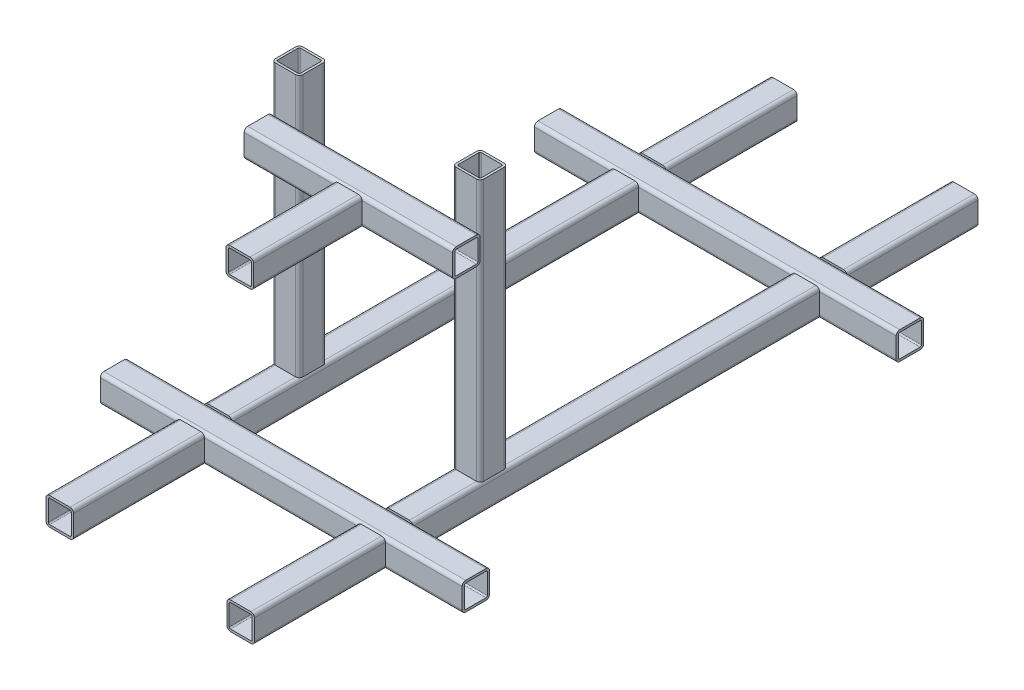
from build123d import *

# Parameters (mm, degrees)
FRONT_CROSS_CAR_MEMBER_DEPTH        = 500
BACK_CROSS_CAR_MEMBER_DEPTH         = 500
BACK_LEFT_ALONG_CAR_MEMBER_DEPTH    = 180.95
MIDDLE_START                        = 219.05
MIDDLE_LEFT_ALONG_CAR_MEMBER_DEPTH  = 561.9
FRONT_START                         = 819.05
FRONT_LEFT_ALONG_CAR_MEMBER_DEPTH   = 180.95
BACK_RIGHT_ALONG_CAR_MEMBER_DEPTH   = 180.95
MIDDLE_RIGHT_ALONG_CAR_MEMBER_DEPTH = 561.9
FRONT_RIGHT_ALONG_CAR_MEMBER_DEPTH  = 180.95
RIGHT_VERTICAL_MEMBER_DEPTH         = 361.9
LEFT_VERTICAL_MEMBER_DEPTH          = 361.9
UPPER_START                         = -105.95
UPPER_CROSS_CAR_MEMBER_DEPTH        = 288.1
E_BOX_START                         = 76.2
E_BOX_PLATFORM_BASE_DEPTH           = 150


with BuildPart() as part:
    # Sketch2 → Front Cross-Car Member (new body)
    with BuildSketch(Plane(origin=(250, 0, 0), x_dir=(0, 0, -1), z_dir=(1, 0, 0))):
        with BuildLine():
            Line((-314.05, 38.1), (-285.95, 38.1))
            ThreePointArc((-285.95, 38.1), (-282.414466094, 36.635533906), (-280.95, 33.1))
            Line((-280.95, 33.1), (-280.95, 5))
            ThreePointArc((-280.95, 5), (-282.414466094, 1.464466094), (-285.95, 0))
            Line((-285.95, 0), (-314.05, 0))
            ThreePointArc((-314.05, 0), (-317.585533906, 1.464466094), (-319.05, 5))
            Line((-319.05, 5), (-319.05, 33.1))
            ThreePointArc((-319.05, 33.1), (-317.585533906, 36.635533906), (-314.05, 38.1))
        make_face()
        with BuildLine():
            Line((-315.875, 33.1), (-315.875, 5))
            ThreePointArc((-315.875, 5), (-315.340469876, 3.709530124), (-314.05, 3.175))
            Line((-314.05, 3.175), (-285.95, 3.175))
            ThreePointArc((-285.95, 3.175), (-284.659530124, 3.709530124), (-284.125, 5))
            Line((-284.125, 5), (-284.125, 33.1))
            ThreePointArc((-284.125, 33.1), (-284.659530124, 34.390469876), (-285.95, 34.925))
            Line((-285.95, 34.925), (-314.05, 34.925))
            ThreePointArc((-314.05, 34.925), (-315.340469876, 34.390469876), (-315.875, 33.1))
        make_face(mode=Mode.SUBTRACT)
    extrude(amount=-FRONT_CROSS_CAR_MEMBER_DEPTH)



with BuildPart() as body_2:
    # Sketch5 → Back Cross-Car Member (new body)
    with BuildSketch(Plane(origin=(250, 0, 0), x_dir=(0, 0, -1), z_dir=(1, 0, 0))):
        with BuildLine():
            Line((285.95, 38.1), (314.05, 38.1))
            ThreePointArc((314.05, 38.1), (317.585533906, 36.635533906), (319.05, 33.1))
            Line((319.05, 33.1), (319.05, 5))
            ThreePointArc((319.05, 5), (317.585533906, 1.464466094), (314.05, 0))
            Line((314.05, 0), (285.95, 0))
            ThreePointArc((285.95, 0), (282.414466094, 1.464466094), (280.95, 5))
            Line((280.95, 5), (280.95, 33.1))
            ThreePointArc((280.95, 33.1), (282.414466094, 36.635533906), (285.95, 38.1))
        make_face()
        with BuildLine():
            Line((285.95, 34.925), (314.05, 34.925))
            ThreePointArc((314.05, 34.925), (315.340469876, 34.390469876), (315.875, 33.1))
            Line((315.875, 33.1), (315.875, 5))
            ThreePointArc((315.875, 5), (315.340469876, 3.709530124), (314.05, 3.175))
            Line((314.05, 3.175), (285.95, 3.175))
            ThreePointArc((285.95, 3.175), (284.659530124, 3.709530124), (284.125, 5))
            Line((284.125, 5), (284.125, 33.1))
            ThreePointArc((284.125, 33.1), (284.659530124, 34.390469876), (285.95, 34.925))
        make_face(mode=Mode.SUBTRACT)
    extrude(amount=-BACK_CROSS_CAR_MEMBER_DEPTH)

    # Sketch6 → Back Left Along-Car Member (add)
    with BuildSketch(Plane.XY.offset(-500)):
        with BuildLine():
            Line((110.95, 38.1), (139.05, 38.1))
            ThreePointArc((139.05, 38.1), (142.585533906, 36.635533906), (144.05, 33.1))
            Line((144.05, 33.1), (144.05, 5))
            ThreePointArc((144.05, 5), (142.585533906, 1.464466094), (139.05, 0))
            Line((139.05, 0), (110.95, 0))
            ThreePointArc((110.95, 0), (107.414466094, 1.464466094), (105.95, 5))
            Line((105.95, 5), (105.95, 33.1))
            ThreePointArc((105.95, 33.1), (107.414466094, 36.635533906), (110.95, 38.1))
        make_face()
        with BuildLine():
            Line((109.125, 33.1), (109.125, 5))
            ThreePointArc((109.125, 5), (109.659530124, 3.709530124), (110.95, 3.175))
            Line((110.95, 3.175), (139.05, 3.175))
            ThreePointArc((139.05, 3.175), (140.340469876, 3.709530124), (140.875, 5))
            Line((140.875, 5), (140.875, 33.1))
            ThreePointArc((140.875, 33.1), (140.340469876, 34.390469876), (139.05, 34.925))
            Line((139.05, 34.925), (110.95, 34.925))
            ThreePointArc((110.95, 34.925), (109.659530124, 34.390469876), (109.125, 33.1))
        make_face(mode=Mode.SUBTRACT)
    extrude(amount=BACK_LEFT_ALONG_CAR_MEMBER_DEPTH)


with BuildPart() as part_1:
    add(part.part)

    add(body_2.part)  # Middle Left Along-Car Member merges body 2
    # Sketch6<2> → Middle Left Along-Car Member (add)
    with BuildSketch(Plane.XY.offset(-500).offset(MIDDLE_START)):
        with BuildLine():
            Line((110.95, 38.1), (139.05, 38.1))
            ThreePointArc((139.05, 38.1), (142.585533906, 36.635533906), (144.05, 33.1))
            Line((144.05, 33.1), (144.05, 5))
            ThreePointArc((144.05, 5), (142.585533906, 1.464466094), (139.05, 0))
            Line((139.05, 0), (110.95, 0))
            ThreePointArc((110.95, 0), (107.414466094, 1.464466094), (105.95, 5))
            Line((105.95, 5), (105.95, 33.1))
            ThreePointArc((105.95, 33.1), (107.414466094, 36.635533906), (110.95, 38.1))
        make_face()
        with BuildLine():
            Line((109.125, 33.1), (109.125, 5))
            ThreePointArc((109.125, 5), (109.659530124, 3.709530124), (110.95, 3.175))
            Line((110.95, 3.175), (139.05, 3.175))
            ThreePointArc((139.05, 3.175), (140.340469876, 3.709530124), (140.875, 5))
            Line((140.875, 5), (140.875, 33.1))
            ThreePointArc((140.875, 33.1), (140.340469876, 34.390469876), (139.05, 34.925))
            Line((139.05, 34.925), (110.95, 34.925))
            ThreePointArc((110.95, 34.925), (109.659530124, 34.390469876), (109.125, 33.1))
        make_face(mode=Mode.SUBTRACT)
    extrude(amount=MIDDLE_LEFT_ALONG_CAR_MEMBER_DEPTH)

    # Sketch6<3> → Front Left Along-Car Member (add)
    with BuildSketch(Plane.XY.offset(-500).offset(FRONT_START)):
        with BuildLine():
            Line((110.95, 38.1), (139.05, 38.1))
            ThreePointArc((139.05, 38.1), (142.585533906, 36.635533906), (144.05, 33.1))
            Line((144.05, 33.1), (144.05, 5))
            ThreePointArc((144.05, 5), (142.585533906, 1.464466094), (139.05, 0))
            Line((139.05, 0), (110.95, 0))
            ThreePointArc((110.95, 0), (107.414466094, 1.464466094), (105.95, 5))
            Line((105.95, 5), (105.95, 33.1))
            ThreePointArc((105.95, 33.1), (107.414466094, 36.635533906), (110.95, 38.1))
        make_face()
        with BuildLine():
            Line((109.125, 33.1), (109.125, 5))
            ThreePointArc((109.125, 5), (109.659530124, 3.709530124), (110.95, 3.175))
            Line((110.95, 3.175), (139.05, 3.175))
            ThreePointArc((139.05, 3.175), (140.340469876, 3.709530124), (140.875, 5))
            Line((140.875, 5), (140.875, 33.1))
            ThreePointArc((140.875, 33.1), (140.340469876, 34.390469876), (139.05, 34.925))
            Line((139.05, 34.925), (110.95, 34.925))
            ThreePointArc((110.95, 34.925), (109.659530124, 34.390469876), (109.125, 33.1))
        make_face(mode=Mode.SUBTRACT)
    extrude(amount=FRONT_LEFT_ALONG_CAR_MEMBER_DEPTH)

    # Sketch7 → Back Right Along-Car Member (add)
    with BuildSketch(Plane.XY.offset(-500)):
        with BuildLine():
            Line((-139.05, 38.1), (-110.95, 38.1))
            ThreePointArc((-110.95, 38.1), (-107.414466094, 36.635533906), (-105.95, 33.1))
            Line((-105.95, 33.1), (-105.95, 5))
            ThreePointArc((-105.95, 5), (-107.414466094, 1.464466094), (-110.95, 0))
            Line((-110.95, 0), (-139.05, 0))
            ThreePointArc((-139.05, 0), (-142.585533906, 1.464466094), (-144.05, 5))
            Line((-144.05, 5), (-144.05, 33.1))
            ThreePointArc((-144.05, 33.1), (-142.585533906, 36.635533906), (-139.05, 38.1))
        make_face()
        with BuildLine():
            Line((-140.875, 33.1), (-140.875, 5))
            ThreePointArc((-140.875, 5), (-140.340469876, 3.709530124), (-139.05, 3.175))
            Line((-139.05, 3.175), (-110.95, 3.175))
            ThreePointArc((-110.95, 3.175), (-109.659530124, 3.709530124), (-109.125, 5))
            Line((-109.125, 5), (-109.125, 33.1))
            ThreePointArc((-109.125, 33.1), (-109.659530124, 34.390469876), (-110.95, 34.925))
            Line((-110.95, 34.925), (-139.05, 34.925))
            ThreePointArc((-139.05, 34.925), (-140.340469876, 34.390469876), (-140.875, 33.1))
        make_face(mode=Mode.SUBTRACT)
    extrude(amount=BACK_RIGHT_ALONG_CAR_MEMBER_DEPTH)

    # Sketch7<2> → Middle Right Along-Car Member (add)
    with BuildSketch(Plane.XY.offset(-500).offset(MIDDLE_START)):
        with BuildLine():
            Line((-139.05, 38.1), (-110.95, 38.1))
            ThreePointArc((-110.95, 38.1), (-107.414466094, 36.635533906), (-105.95, 33.1))
            Line((-105.95, 33.1), (-105.95, 5))
            ThreePointArc((-105.95, 5), (-107.414466094, 1.464466094), (-110.95, 0))
            Line((-110.95, 0), (-139.05, 0))
            ThreePointArc((-139.05, 0), (-142.585533906, 1.464466094), (-144.05, 5))
            Line((-144.05, 5), (-144.05, 33.1))
            ThreePointArc((-144.05, 33.1), (-142.585533906, 36.635533906), (-139.05, 38.1))
        make_face()
        with BuildLine():
            Line((-140.875, 33.1), (-140.875, 5))
            ThreePointArc((-140.875, 5), (-140.340469876, 3.709530124), (-139.05, 3.175))
            Line((-139.05, 3.175), (-110.95, 3.175))
            ThreePointArc((-110.95, 3.175), (-109.659530124, 3.709530124), (-109.125, 5))
            Line((-109.125, 5), (-109.125, 33.1))
            ThreePointArc((-109.125, 33.1), (-109.659530124, 34.390469876), (-110.95, 34.925))
            Line((-110.95, 34.925), (-139.05, 34.925))
            ThreePointArc((-139.05, 34.925), (-140.340469876, 34.390469876), (-140.875, 33.1))
        make_face(mode=Mode.SUBTRACT)
    extrude(amount=MIDDLE_RIGHT_ALONG_CAR_MEMBER_DEPTH)

    # Sketch7<3> → Front Right Along-Car Member (add)
    with BuildSketch(Plane.XY.offset(-500).offset(FRONT_START)):
        with BuildLine():
            Line((-139.05, 38.1), (-110.95, 38.1))
            ThreePointArc((-110.95, 38.1), (-107.414466094, 36.635533906), (-105.95, 33.1))
            Line((-105.95, 33.1), (-105.95, 5))
            ThreePointArc((-105.95, 5), (-107.414466094, 1.464466094), (-110.95, 0))
            Line((-110.95, 0), (-139.05, 0))
            ThreePointArc((-139.05, 0), (-142.585533906, 1.464466094), (-144.05, 5))
            Line((-144.05, 5), (-144.05, 33.1))
            ThreePointArc((-144.05, 33.1), (-142.585533906, 36.635533906), (-139.05, 38.1))
        make_face()
        with BuildLine():
            Line((-140.875, 33.1), (-140.875, 5))
            ThreePointArc((-140.875, 5), (-140.340469876, 3.709530124), (-139.05, 3.175))
            Line((-139.05, 3.175), (-110.95, 3.175))
            ThreePointArc((-110.95, 3.175), (-109.659530124, 3.709530124), (-109.125, 5))
            Line((-109.125, 5), (-109.125, 33.1))
            ThreePointArc((-109.125, 33.1), (-109.659530124, 34.390469876), (-110.95, 34.925))
            Line((-110.95, 34.925), (-139.05, 34.925))
            ThreePointArc((-139.05, 34.925), (-140.340469876, 34.390469876), (-140.875, 33.1))
        make_face(mode=Mode.SUBTRACT)
    extrude(amount=FRONT_RIGHT_ALONG_CAR_MEMBER_DEPTH)

    # Sketch8 → Right Vertical Member (add)
    with BuildSketch(Plane(origin=(0, 38.1, 0), x_dir=(1, 0, 0), z_dir=(0, 1, 0))):
        with BuildLine():
            Line((-139.05, -150), (-110.95, -150))
            ThreePointArc((-110.95, -150), (-107.414466094, -151.464466094), (-105.95, -155))
            Line((-105.95, -155), (-105.95, -183.1))
            ThreePointArc((-105.95, -183.1), (-107.414466094, -186.635533906), (-110.95, -188.1))
            Line((-110.95, -188.1), (-139.05, -188.1))
            ThreePointArc((-139.05, -188.1), (-142.585533906, -186.635533906), (-144.05, -183.1))
            Line((-144.05, -183.1), (-144.05, -155))
            ThreePointArc((-144.05, -155), (-142.585533906, -151.464466094), (-139.05, -150))
        make_face()
        with BuildLine():
            Line((-140.875, -155), (-140.875, -183.1))
            ThreePointArc((-140.875, -183.1), (-140.340469876, -184.390469876), (-139.05, -184.925))
            Line((-139.05, -184.925), (-110.95, -184.925))
            ThreePointArc((-110.95, -184.925), (-109.659530124, -184.390469876), (-109.125, -183.1))
            Line((-109.125, -183.1), (-109.125, -155))
            ThreePointArc((-109.125, -155), (-109.659530124, -153.709530124), (-110.95, -153.175))
            Line((-110.95, -153.175), (-139.05, -153.175))
            ThreePointArc((-139.05, -153.175), (-140.340469876, -153.709530124), (-140.875, -155))
        make_face(mode=Mode.SUBTRACT)
    extrude(amount=RIGHT_VERTICAL_MEMBER_DEPTH)

    # Sketch10 → Left Vertical Member (add)
    with BuildSketch(Plane(origin=(0, 38.1, 0), x_dir=(1, 0, 0), z_dir=(0, 1, 0))):
        with BuildLine():
            Line((110.95, -150), (139.05, -150))
            ThreePointArc((139.05, -150), (142.585533906, -151.464466094), (144.05, -155))
            Line((144.05, -155), (144.05, -183.1))
            ThreePointArc((144.05, -183.1), (142.585533906, -186.635533906), (139.05, -188.1))
            Line((139.05, -188.1), (110.95, -188.1))
            ThreePointArc((110.95, -188.1), (107.414466094, -186.635533906), (105.95, -183.1))
            Line((105.95, -183.1), (105.95, -155))
            ThreePointArc((105.95, -155), (107.414466094, -151.464466094), (110.95, -150))
        make_face()
        with BuildLine():
            Line((109.125, -155), (109.125, -183.1))
            ThreePointArc((109.125, -183.1), (109.659530124, -184.390469876), (110.95, -184.925))
            Line((110.95, -184.925), (139.05, -184.925))
            ThreePointArc((139.05, -184.925), (140.340469876, -184.390469876), (140.875, -183.1))
            Line((140.875, -183.1), (140.875, -155))
            ThreePointArc((140.875, -155), (140.340469876, -153.709530124), (139.05, -153.175))
            Line((139.05, -153.175), (110.95, -153.175))
            ThreePointArc((110.95, -153.175), (109.659530124, -153.709530124), (109.125, -155))
        make_face(mode=Mode.SUBTRACT)
    extrude(amount=LEFT_VERTICAL_MEMBER_DEPTH)

    # Sketch11 → Upper Cross-Car Member (add)
    with BuildSketch(Plane(origin=(250, 0, 0), x_dir=(0, 0, -1), z_dir=(1, 0, 0)).offset(UPPER_START)):
        with BuildLine():
            Line((-221.2, 338.1), (-193.1, 338.1))
            ThreePointArc((-193.1, 338.1), (-189.564466094, 336.635533906), (-188.1, 333.1))
            Line((-188.1, 333.1), (-188.1, 305))
            ThreePointArc((-188.1, 305), (-189.564466094, 301.464466094), (-193.1, 300))
            Line((-193.1, 300), (-221.2, 300))
            ThreePointArc((-221.2, 300), (-224.735533906, 301.464466094), (-226.2, 305))
            Line((-226.2, 305), (-226.2, 333.1))
            ThreePointArc((-226.2, 333.1), (-224.735533906, 336.635533906), (-221.2, 338.1))
        make_face()
        with BuildLine():
            Line((-223.025, 333.1), (-223.025, 305))
            ThreePointArc((-223.025, 305), (-222.490469876, 303.709530124), (-221.2, 303.175))
            Line((-221.2, 303.175), (-193.1, 303.175))
            ThreePointArc((-193.1, 303.175), (-191.809530124, 303.709530124), (-191.275, 305))
            Line((-191.275, 305), (-191.275, 333.1))
            ThreePointArc((-191.275, 333.1), (-191.809530124, 334.390469876), (-193.1, 334.925))
            Line((-193.1, 334.925), (-221.2, 334.925))
            ThreePointArc((-221.2, 334.925), (-222.490469876, 334.390469876), (-223.025, 333.1))
        make_face(mode=Mode.SUBTRACT)
    extrude(amount=-UPPER_CROSS_CAR_MEMBER_DEPTH)

    # Sketch12 → E-Box Platform Base (add)
    with BuildSketch(Plane.XY.offset(150).offset(E_BOX_START)):
        with BuildLine():
            Line((-14.05, 338.1), (14.05, 338.1))
            ThreePointArc((14.05, 338.1), (17.585533906, 336.635533906), (19.05, 333.1))
            Line((19.05, 333.1), (19.05, 305))
            ThreePointArc((19.05, 305), (17.585533906, 301.464466094), (14.05, 300))
            Line((14.05, 300), (-14.05, 300))
            ThreePointArc((-14.05, 300), (-17.585533906, 301.464466094), (-19.05, 305))
            Line((-19.05, 305), (-19.05, 333.1))
            ThreePointArc((-19.05, 333.1), (-17.585533906, 336.635533906), (-14.05, 338.1))
        make_face()
        with BuildLine():
            Line((-15.875, 333.1), (-15.875, 305))
            ThreePointArc((-15.875, 305), (-15.340469876, 303.709530124), (-14.05, 303.175))
            Line((-14.05, 303.175), (14.05, 303.175))
            ThreePointArc((14.05, 303.175), (15.340469876, 303.709530124), (15.875, 305))
            Line((15.875, 305), (15.875, 333.1))
            ThreePointArc((15.875, 333.1), (15.340469876, 334.390469876), (14.05, 334.925))
            Line((14.05, 334.925), (-14.05, 334.925))
            ThreePointArc((-14.05, 334.925), (-15.340469876, 334.390469876), (-15.875, 333.1))
        make_face(mode=Mode.SUBTRACT)
    extrude(amount=E_BOX_PLATFORM_BASE_DEPTH)


solid = part_1.part
